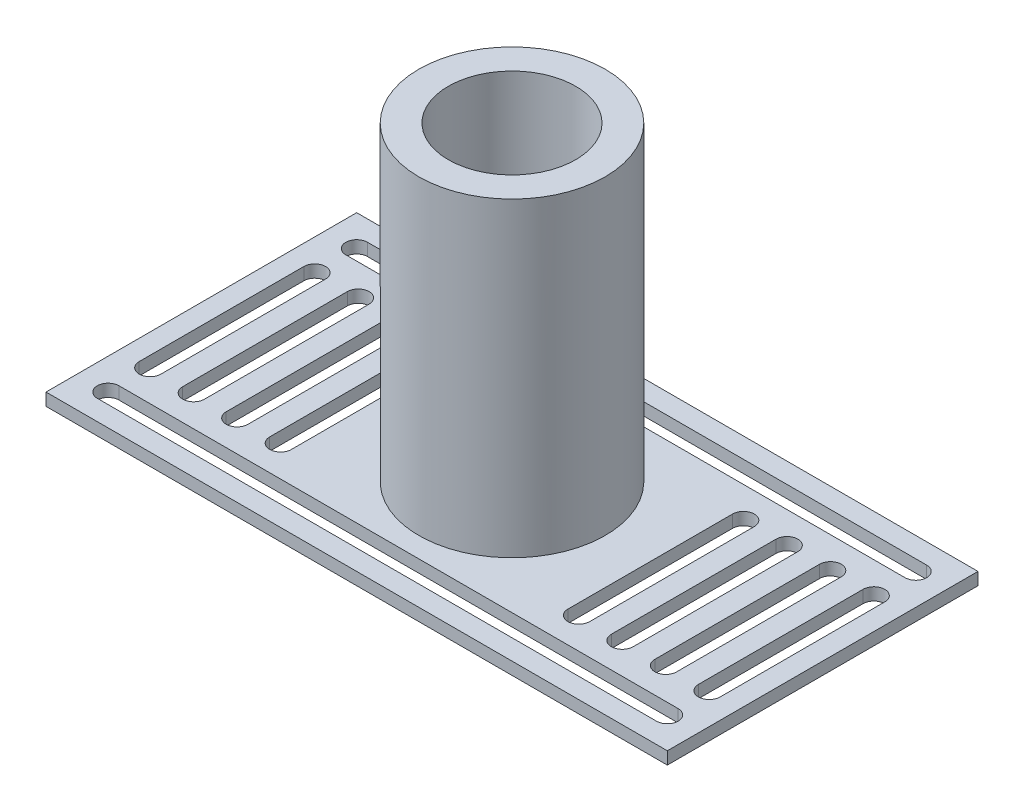
from build123d import *

# Parameters (mm, degrees)
SKETCH_1_W          = 100
SKETCH_1_H          = 50
EXTRUDE_1_DEPTH     = 2
SKETCH_2_R          = 15
SKETCH_2_R_2        = 10.25
EXTRUDE_2_DEPTH     = 50
CUT_EXTRUDE_1_DEPTH = 30


with BuildPart() as part:
    # 草图1 → 凸台-拉伸1 (new body)
    with BuildSketch(Plane(origin=(0, 0, 0), x_dir=(1, 0, 0), z_dir=(0, 1, 0))):
        with Locations((51.31061599, 25)):
            Rectangle(SKETCH_1_W, SKETCH_1_H)
    extrude(amount=EXTRUDE_1_DEPTH)

    # 草图2 → 凸台-拉伸2 (add)
    with BuildSketch(Plane(origin=(0, 2, 0), x_dir=(1, 0, 0), z_dir=(0, 1, 0))):
        with Locations(Location((51.31061599, 25, 0), (0, 0, 90))):
            Circle(SKETCH_2_R)
        with Locations(Location((51.31061599, 25, 0), (0, 0, 270))):
            Circle(SKETCH_2_R_2, mode=Mode.SUBTRACT)
    extrude(amount=EXTRUDE_2_DEPTH)

    # 草图3 → 切除-拉伸1 (cut)
    with BuildSketch(Plane.XZ):
        with BuildLine():
            Line((6.31061599, -3.25), (96.31061599, -3.25))
            ThreePointArc((96.31061599, -3.25), (98.06061599, -5), (96.31061599, -6.75))
            Line((96.31061599, -6.75), (6.31061599, -6.75))
            ThreePointArc((6.31061599, -6.75), (4.56061599, -5), (6.31061599, -3.25))
        make_face()
        with BuildLine():
            Line((6.31061599, -46.75), (96.31061599, -46.75))
            ThreePointArc((96.31061599, -46.75), (98.06061599, -45), (96.31061599, -43.25))
            Line((96.31061599, -43.25), (6.31061599, -43.25))
            ThreePointArc((6.31061599, -43.25), (4.56061599, -45), (6.31061599, -46.75))
        make_face()
        with BuildLine():
            Line((8.06061599, -11.75), (8.06061599, -38.25))
            ThreePointArc((8.06061599, -38.25), (6.31061599, -40), (4.56061599, -38.25))
            Line((4.56061599, -38.25), (4.56061599, -11.75))
            ThreePointArc((4.56061599, -11.75), (6.31061599, -10), (8.06061599, -11.75))
        make_face()
        with BuildLine():
            Line((94.56061599, -11.75), (94.56061599, -38.25))
            ThreePointArc((94.56061599, -38.25), (96.31061599, -40), (98.06061599, -38.25))
            Line((98.06061599, -38.25), (98.06061599, -11.75))
            ThreePointArc((98.06061599, -11.75), (96.31061599, -10), (94.56061599, -11.75))
        make_face()
        with BuildLine():
            Line((15.06061599, -11.75), (15.06061599, -38.25))
            ThreePointArc((15.06061599, -38.25), (13.31061599, -40), (11.56061599, -38.25))
            Line((11.56061599, -38.25), (11.56061599, -11.75))
            ThreePointArc((11.56061599, -11.75), (13.31061599, -10), (15.06061599, -11.75))
        make_face()
        with BuildLine():
            Line((22.06061599, -11.75), (22.06061599, -38.25))
            ThreePointArc((22.06061599, -38.25), (20.31061599, -40), (18.56061599, -38.25))
            Line((18.56061599, -38.25), (18.56061599, -11.75))
            ThreePointArc((18.56061599, -11.75), (20.31061599, -10), (22.06061599, -11.75))
        make_face()
        with BuildLine():
            Line((29.06061599, -11.75), (29.06061599, -38.25))
            ThreePointArc((29.06061599, -38.25), (27.31061599, -40), (25.56061599, -38.25))
            Line((25.56061599, -38.25), (25.56061599, -11.75))
            ThreePointArc((25.56061599, -11.75), (27.31061599, -10), (29.06061599, -11.75))
        make_face()
        with BuildLine():
            Line((87.56061599, -11.75), (87.56061599, -38.25))
            ThreePointArc((87.56061599, -38.25), (89.31061599, -40), (91.06061599, -38.25))
            Line((91.06061599, -38.25), (91.06061599, -11.75))
            ThreePointArc((91.06061599, -11.75), (89.31061599, -10), (87.56061599, -11.75))
        make_face()
        with BuildLine():
            Line((80.56061599, -11.75), (80.56061599, -38.25))
            ThreePointArc((80.56061599, -38.25), (82.31061599, -40), (84.06061599, -38.25))
            Line((84.06061599, -38.25), (84.06061599, -11.75))
            ThreePointArc((84.06061599, -11.75), (82.31061599, -10), (80.56061599, -11.75))
        make_face()
        with BuildLine():
            Line((73.56061599, -11.75), (73.56061599, -38.25))
            ThreePointArc((73.56061599, -38.25), (75.31061599, -40), (77.06061599, -38.25))
            Line((77.06061599, -38.25), (77.06061599, -11.75))
            ThreePointArc((77.06061599, -11.75), (75.31061599, -10), (73.56061599, -11.75))
        make_face()
    extrude(amount=-CUT_EXTRUDE_1_DEPTH, mode=Mode.SUBTRACT)


solid = part.part
